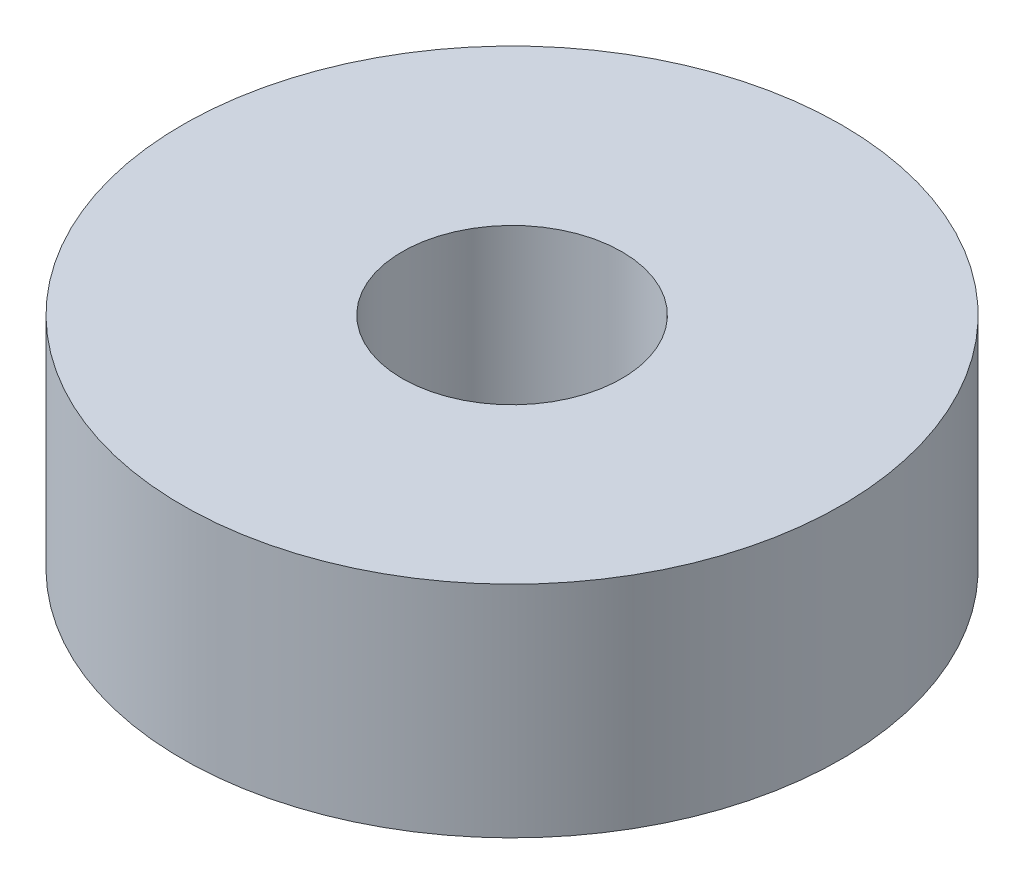
from build123d import *

# Parameters (mm, degrees)
SKETCH_1_W = 10
SKETCH_1_H = 10


with BuildPart() as part:
    # 草图1 → 旋转1 (revolve)
    with BuildSketch(Plane.XY, mode=Mode.PRIVATE) as revolve_1_sk:
        with Locations((10, 5)):
            Rectangle(SKETCH_1_W, SKETCH_1_H)
    revolve(revolve_1_sk.sketch.rotate(Axis((0, 0, 0), (0, 1, 0)), 90), axis=Axis((0, 0, 0), (0, 1, 0)))


solid = part.part
